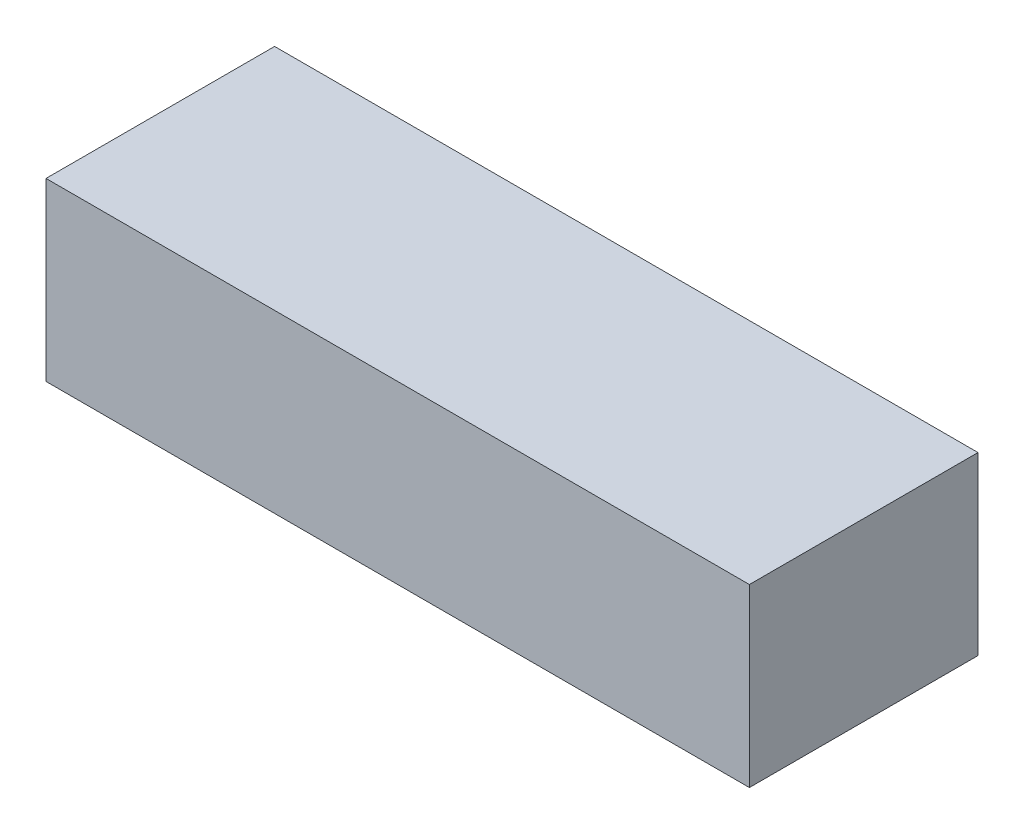
from build123d import *

# Parameters (mm, degrees)
SKETCH1_W           = 40
SKETCH1_H           = 13
BOSS_EXTRUDE1_DEPTH = 10


with BuildPart() as part:
    # Sketch1 → Boss-Extrude1 (new body)
    with BuildSketch(Plane(origin=(0, 0, 0), x_dir=(1, 0, 0), z_dir=(0, 1, 0))):
        with Locations((20, 6.5)):
            Rectangle(SKETCH1_W, SKETCH1_H)
    extrude(amount=BOSS_EXTRUDE1_DEPTH)


solid = part.part
